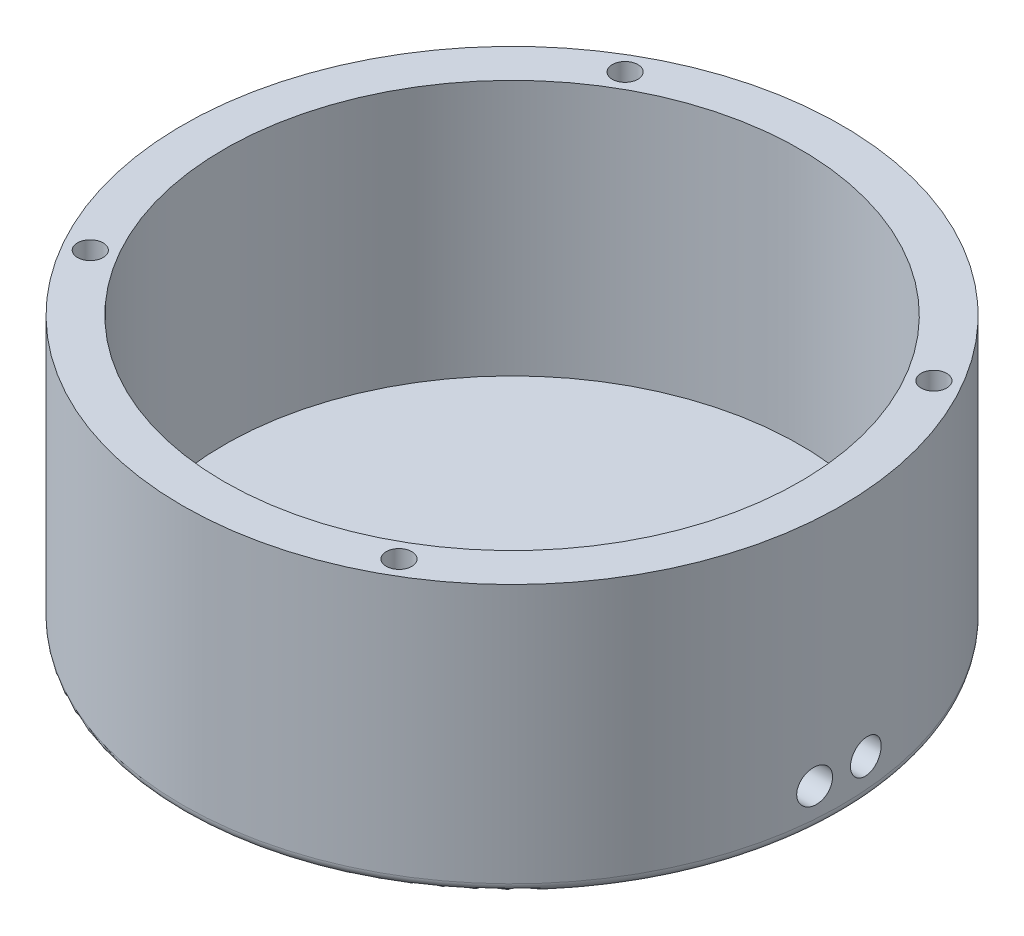
from build123d import *

# Parameters (mm, degrees)
SKETCH1_R                = 51.5
BOSS_EXTRUDE1_DEPTH      = 42
SKETCH2_R                = 45
CUT_EXTRUDE1_DEPTH       = 40
FILLET1_R                = 1.5
SKETCH6_R                = 2
CUT_EXTRUDE6_DEPTH       = 10
CUT_EXTRUDE12_DEPTH      = 15
CUT_EXTRUDE12_DEPTH_BACK = 15
SKETCH15_R               = 2.6
SKETCH17_R               = 6
CUT_EXTRUDE13_DEPTH      = 1
SKETCH18_R               = 0.25
SKETCH18_R_2             = 0.5
CUT_EXTRUDE14_DEPTH      = 1


with BuildPart() as part:
    # Sketch1 → Boss-Extrude1 (new body)
    with BuildSketch(Plane(origin=(0, 0, 0), x_dir=(1, 0, 0), z_dir=(0, 1, 0))):
        Circle(SKETCH1_R)
    extrude(amount=BOSS_EXTRUDE1_DEPTH)

    # Sketch2 → Cut-Extrude1 (cut)
    with BuildSketch(Plane(origin=(0, 42, 0), x_dir=(1, 0, 0), z_dir=(0, 1, 0))):
        Circle(SKETCH2_R)
    extrude(amount=-CUT_EXTRUDE1_DEPTH, mode=Mode.SUBTRACT)

    # Fillet1
    fillet1_edges = [part.edges().sort_by_distance(p)[0] for p in [
        (-51.5, 0, 0),
    ]]
    fillet(fillet1_edges, radius=FILLET1_R)

    # Sketch6 → Cut-Extrude6 (cut)
    with BuildSketch(Plane(origin=(0, 42, 0), x_dir=(1, 0, 0), z_dir=(0, 1, 0))):
        with Locations((41.785725733, 24.125)):
            Circle(SKETCH6_R)
        with Locations((-24.125, 41.785725733)):
            Circle(SKETCH6_R)
        with Locations((24.125, -41.785725733)):
            Circle(SKETCH6_R)
        with Locations((-41.785725733, -24.125)):
            Circle(SKETCH6_R)
    extrude(amount=-CUT_EXTRUDE6_DEPTH, mode=Mode.SUBTRACT)

    # Sketch15 → Cut-Extrude12 (cut, two sides: drawn at the far end of the back side and taken through both)
    with BuildSketch(Plane.ZY.offset(-47.5).offset(-CUT_EXTRUDE12_DEPTH_BACK)):
        with Locations((-4, 6)):
            Circle(SKETCH15_R)
        with Locations((4, 6)):
            Circle(SKETCH15_R)
    extrude(amount=CUT_EXTRUDE12_DEPTH + CUT_EXTRUDE12_DEPTH_BACK, mode=Mode.SUBTRACT)

    # Sketch17 → Cut-Extrude13 (cut)
    with BuildSketch(Plane(origin=(0, 2, 0), x_dir=(1, 0, 0), z_dir=(0, 1, 0))):
        Circle(SKETCH17_R)
    extrude(amount=-CUT_EXTRUDE13_DEPTH, mode=Mode.SUBTRACT)

    # Sketch18 → Cut-Extrude14 (cut)
    with BuildSketch(Plane(origin=(0, 1, 0), x_dir=(1, 0, 0), z_dir=(0, 1, 0))):
        with Locations((-1.5, 0)):
            Circle(SKETCH18_R)
        with Locations((-2.5, 0)):
            Circle(SKETCH18_R)
        with Locations((-3.5, 0)):
            Circle(SKETCH18_R)
        with Locations((-4.5, 0)):
            Circle(SKETCH18_R)
        with Locations((-1.299038106, 0.75)):
            Circle(SKETCH18_R)
        with Locations((-2.165063509, 1.25)):
            Circle(SKETCH18_R)
        with Locations((-3.031088913, 1.75)):
            Circle(SKETCH18_R)
        with Locations((-3.897114317, 2.25)):
            Circle(SKETCH18_R)
        with Locations((-0.75, 1.299038106)):
            Circle(SKETCH18_R)
        with Locations((-1.25, 2.165063509)):
            Circle(SKETCH18_R)
        with Locations((-1.75, 3.031088913)):
            Circle(SKETCH18_R)
        with Locations((-2.25, 3.897114317)):
            Circle(SKETCH18_R)
        with Locations((0, 4.5)):
            Circle(SKETCH18_R)
        with Locations((0, 3.5)):
            Circle(SKETCH18_R)
        with Locations((0, 2.5)):
            Circle(SKETCH18_R)
        with Locations((0, 1.5)):
            Circle(SKETCH18_R)
        with Locations((0.75, 1.299038106)):
            Circle(SKETCH18_R)
        with Locations((1.25, 2.165063509)):
            Circle(SKETCH18_R)
        with Locations((1.75, 3.031088913)):
            Circle(SKETCH18_R)
        with Locations((2.25, 3.897114317)):
            Circle(SKETCH18_R)
        with Locations((3.897114317, 2.25)):
            Circle(SKETCH18_R)
        with Locations((3.031088913, 1.75)):
            Circle(SKETCH18_R)
        with Locations((2.165063509, 1.25)):
            Circle(SKETCH18_R)
        with Locations((1.299038106, 0.75)):
            Circle(SKETCH18_R)
        with Locations((4.5, 0)):
            Circle(SKETCH18_R)
        with Locations((3.5, 0)):
            Circle(SKETCH18_R)
        with Locations((2.5, 0)):
            Circle(SKETCH18_R)
        with Locations((1.5, 0)):
            Circle(SKETCH18_R)
        with Locations((3.897114317, -2.25)):
            Circle(SKETCH18_R)
        with Locations((3.031088913, -1.75)):
            Circle(SKETCH18_R)
        with Locations((2.165063509, -1.25)):
            Circle(SKETCH18_R)
        with Locations((1.299038106, -0.75)):
            Circle(SKETCH18_R)
        with Locations((2.25, -3.897114317)):
            Circle(SKETCH18_R)
        with Locations((1.75, -3.031088913)):
            Circle(SKETCH18_R)
        with Locations((1.25, -2.165063509)):
            Circle(SKETCH18_R)
        with Locations((0.75, -1.299038106)):
            Circle(SKETCH18_R)
        with Locations((0, -1.6)):
            Circle(SKETCH18_R)
        with Locations((0, -2.5)):
            Circle(SKETCH18_R)
        with Locations((0, -3.5)):
            Circle(SKETCH18_R)
        with Locations((0, -4.5)):
            Circle(SKETCH18_R)
        with Locations((-0.75, -1.299038106)):
            Circle(SKETCH18_R)
        with Locations((-1.25, -2.165063509)):
            Circle(SKETCH18_R)
        with Locations((-1.75, -3.031088913)):
            Circle(SKETCH18_R)
        with Locations((-2.25, -3.897114317)):
            Circle(SKETCH18_R)
        with Locations((-1.299038106, -0.75)):
            Circle(SKETCH18_R)
        with Locations((-2.165063509, -1.25)):
            Circle(SKETCH18_R)
        with Locations((-3.031088913, -1.75)):
            Circle(SKETCH18_R)
        with Locations((-3.897114317, -2.25)):
            Circle(SKETCH18_R)
        Circle(SKETCH18_R_2)
    extrude(amount=-CUT_EXTRUDE14_DEPTH, mode=Mode.SUBTRACT)


solid = part.part
